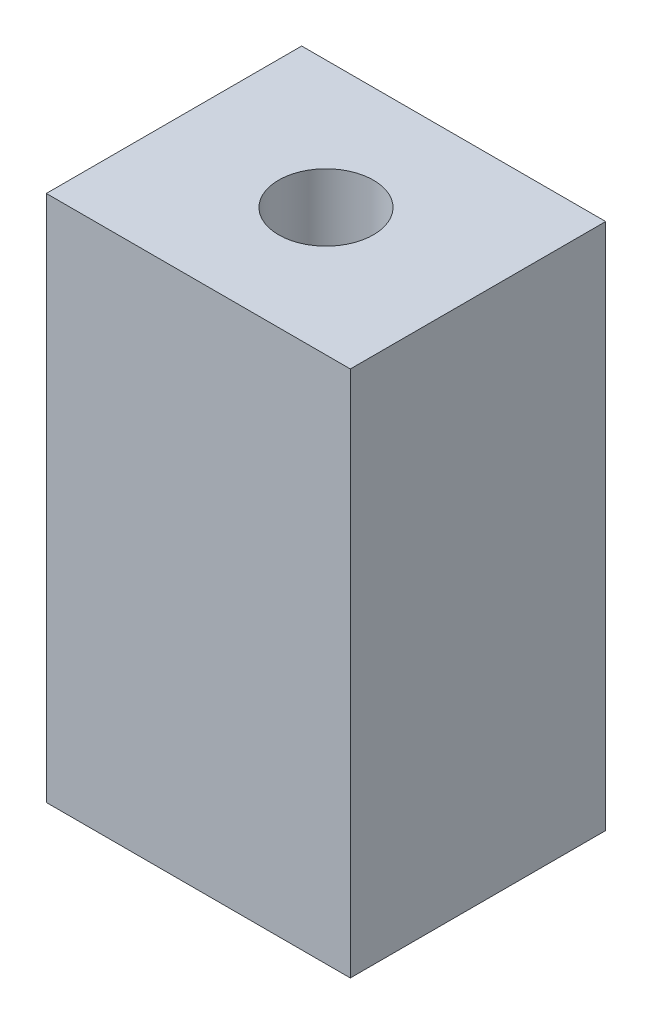
from build123d import *

# Parameters (mm, degrees)
SKETCH1_W           = 25.4
SKETCH1_H           = 21.336
SKETCH1_R           = 3.9624
BOSS_EXTRUDE1_DEPTH = 44.069
SKETCH3_R           = 2.286
CUT_EXTRUDE2_DEPTH  = 3.175


with BuildPart() as part:
    # Sketch1 → Boss-Extrude1 (new body)
    with BuildSketch(Plane(origin=(0, 0, 0), x_dir=(1, 0, 0), z_dir=(0, 1, 0))):
        with Locations((12.7, -10.668)):
            Rectangle(SKETCH1_W, SKETCH1_H)
        with Locations(Location((12.7, -10.668, 0), (0, 0, 270))):
            Circle(SKETCH1_R, mode=Mode.SUBTRACT)
    extrude(amount=BOSS_EXTRUDE1_DEPTH)

    # Sketch3 → Cut-Extrude2 (cut)
    with BuildSketch(Plane.ZY):
        with Locations((16.1798, 32.258)):
            Circle(SKETCH3_R)
        with Locations((5.1562, 19.558)):
            Circle(SKETCH3_R)
    extrude(amount=-CUT_EXTRUDE2_DEPTH, mode=Mode.SUBTRACT)


solid = part.part
